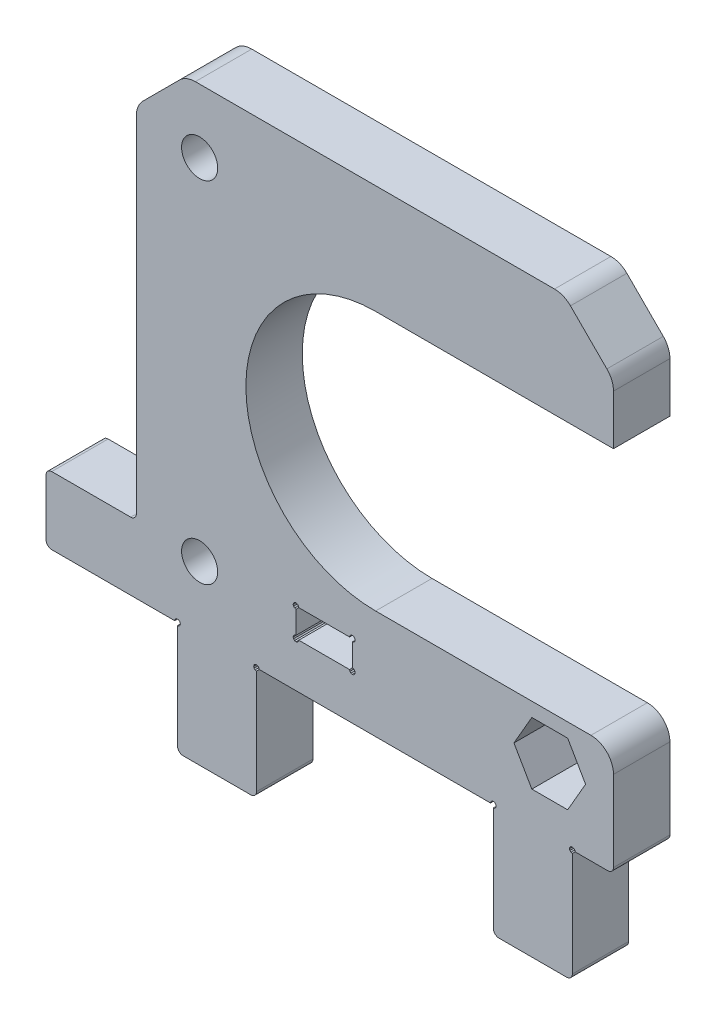
from build123d import *

# Parameters (mm, degrees)
ESQUISSE1_R        = 1.6
BOSS_EXTRU_1_DEPTH = 5


with BuildPart() as part:
    # Esquisse1 → Boss.-Extru.1 (new body)
    with BuildSketch(Plane(origin=(0, 0, 0), x_dir=(-1, 0, 0), z_dir=(0, 0, -1))):
        with BuildLine():
            Line((-13.228382526, 52.300004127), (-45.071523458, 52.300004127))
            ThreePointArc((-45.071523458, 52.300004127), (-45.836893076, 52.147762644), (-46.485742108, 51.714215582))
            Line((-46.485742108, 51.714215582), (-49.714164045, 48.485793645))
            ThreePointArc((-49.714164045, 48.485793645), (-50.147712239, 47.836942919), (-50.299954119, 47.071571303))
            Line((-50.299954119, 47.071571303), (-50.299954119, 42.65))
            Line((-50.299954119, 42.65), (-29.210001453, 42.65))
            ThreePointArc((-29.210001453, 42.65), (-17.71, 31.15), (-29.210001453, 19.65))
            Line((-29.210001453, 19.65), (-48.299953866, 19.65))
            ThreePointArc((-48.299953866, 19.65), (-49.714167607, 19.064213488), (-50.299954119, 17.649999747))
            Line((-50.299954119, 17.649999747), (-50.299954119, 10.499998844))
            ThreePointArc((-50.299954119, 10.499998844), (-50.153507491, 10.146445408), (-49.799954056, 9.99999878))
            Line((-49.799954056, 9.99999878), (-46.899953689, 9.99999878))
            Line((-46.899953689, 9.99999878), (-46.866453685, 10.124998796))
            Line((-46.866453685, 10.124998796), (-46.774953673, 10.216508808))
            Line((-46.774953673, 10.216508808), (-46.649953658, 10.249998812))
            Line((-46.649953658, 10.249998812), (-46.524953642, 10.216508808))
            Line((-46.524953642, 10.216508808), (-46.43344363, 10.124998796))
            Line((-46.43344363, 10.124998796), (-46.399953626, 9.99999878))
            Line((-46.399953626, 9.99999878), (-46.43344363, 9.874998765))
            Line((-46.43344363, 9.874998765), (-46.524953642, 9.783491753))
            Line((-46.524953642, 9.783491753), (-46.649953658, 9.749998749))
            Line((-46.649953658, 9.749998749), (-46.649953658, 0.49999758))
            ThreePointArc((-46.649953658, 0.49999758), (-46.50350703, 0.146444144), (-46.149953594, -2.484e-06))
            Line((-46.149953594, -2.484e-06), (-40.149952936, -2.484e-06))
            ThreePointArc((-40.149952936, -2.484e-06), (-39.79639943, 0.146444174), (-39.649952773, 0.49999768))
            Line((-39.649952773, 0.49999768), (-39.649952773, 9.749998749))
            Line((-39.649952773, 9.749998749), (-39.774952789, 9.783491753))
            Line((-39.774952789, 9.783491753), (-39.8664628, 9.874998765))
            Line((-39.8664628, 9.874998765), (-39.899952805, 9.99999878))
            Line((-39.899952805, 9.99999878), (-39.8664628, 10.124998796))
            Line((-39.8664628, 10.124998796), (-39.774952789, 10.216508808))
            Line((-39.774952789, 10.216508808), (-39.649952773, 10.249998812))
            Line((-39.649952773, 10.249998812), (-39.524952757, 10.216508808))
            Line((-39.524952757, 10.216508808), (-39.433442746, 10.124998796))
            Line((-39.433442746, 10.124998796), (-39.399952741, 9.99999878))
            Line((-39.399952741, 9.99999878), (-18.89995015, 9.99999878))
            Line((-18.89995015, 9.99999878), (-18.866450146, 10.124998796))
            Line((-18.866450146, 10.124998796), (-18.774950135, 10.216508808))
            Line((-18.774950135, 10.216508808), (-18.649950119, 10.249998812))
            Line((-18.649950119, 10.249998812), (-18.524950103, 10.216508808))
            Line((-18.524950103, 10.216508808), (-18.433440091, 10.124998796))
            Line((-18.433440091, 10.124998796), (-18.399950087, 9.99999878))
            Line((-18.399950087, 9.99999878), (-18.433440091, 9.874998765))
            Line((-18.433440091, 9.874998765), (-18.524950103, 9.783491753))
            Line((-18.524950103, 9.783491753), (-18.649950119, 9.749998749))
            Line((-18.649950119, 9.749998749), (-18.649950119, 0.49999758))
            ThreePointArc((-18.649950119, 0.49999758), (-18.503503491, 0.146444144), (-18.149950056, -2.484e-06))
            Line((-18.149950056, -2.484e-06), (-12.149949397, -2.484e-06))
            ThreePointArc((-12.149949397, -2.484e-06), (-11.796395891, 0.146444174), (-11.649949234, 0.49999768))
            Line((-11.649949234, 0.49999768), (-11.649949234, 9.749998749))
            Line((-11.649949234, 9.749998749), (-11.77494925, 9.783491753))
            Line((-11.77494925, 9.783491753), (-11.866459261, 9.874998765))
            Line((-11.866459261, 9.874998765), (-11.899949266, 9.99999878))
            Line((-11.899949266, 9.99999878), (-11.866459261, 10.124998796))
            Line((-11.866459261, 10.124998796), (-11.77494925, 10.216508808))
            Line((-11.77494925, 10.216508808), (-11.649949234, 10.249998812))
            Line((-11.649949234, 10.249998812), (-11.524949218, 10.216508808))
            Line((-11.524949218, 10.216508808), (-11.433439207, 10.124998796))
            Line((-11.433439207, 10.124998796), (-11.399949202, 9.99999878))
            Line((-11.399949202, 9.99999878), (-0.499947825, 9.99999878))
            ThreePointArc((-0.499947825, 9.99999878), (-0.14639439, 10.146445408), (5.2238e-05, 10.499998844))
            Line((5.2238e-05, 10.499998844), (5.2238e-05, 15.499999475))
            ThreePointArc((5.2238e-05, 15.499999475), (-0.14639439, 15.853552911), (-0.499947825, 15.999999539))
            Line((-0.499947825, 15.999999539), (-7.49994871, 15.999999539))
            ThreePointArc((-7.49994871, 15.999999539), (-7.853502145, 16.146446167), (-7.999948773, 16.499999602))
            Line((-7.999948773, 16.499999602), (-7.999948773, 47.071573466))
            ThreePointArc((-7.999948773, 47.071573466), (-8.152190984, 47.836946285), (-8.585740096, 48.485797894))
            Line((-8.585740096, 48.485797894), (-11.814159255, 51.714214053))
            ThreePointArc((-11.814159255, 51.714214053), (-12.46301048, 52.147762254), (-13.228382526, 52.300004127))
        make_face()
        with Locations((-13.61, 46.65)):
            Circle(ESQUISSE1_R, mode=Mode.SUBTRACT)
        with Locations((-13.61, 15.65)):
            Circle(ESQUISSE1_R, mode=Mode.SUBTRACT)
        Polygon((-22.025002784, 14.216511797), (-21.933492772, 14.125001785), (-21.900002768, 14.000001769), (-21.933492772, 13.875001754), (-22.025002784, 13.783491742), (-22.1500028, 13.750001738), (-22.275002815, 13.783491742), (-22.366502827, 13.875001754), (-22.400002831, 14.000001769), (-26.9000034, 14.000001769), (-26.933493404, 13.875001754), (-27.025003416, 13.783491742), (-27.150003431, 13.750001738), (-27.275003447, 13.783491742), (-27.366513459, 13.875001754), (-27.400003463, 14.000001769), (-27.366513459, 14.125001785), (-27.275003447, 14.216511797), (-27.150003431, 14.250001801), (-27.150003431, 16.250002054), (-27.275003447, 16.283492058), (-27.366513459, 16.37500207), (-27.400003463, 16.500002085), (-27.366513459, 16.625002101), (-27.275003447, 16.716512113), (-27.150003431, 16.750002117), (-27.025003416, 16.716512113), (-26.933493404, 16.625002101), (-26.9000034, 16.500002085), (-22.400002831, 16.500002085), (-22.366502827, 16.625002101), (-22.275002815, 16.716512113), (-22.1500028, 16.750002117), (-22.025002784, 16.716512113), (-21.933492772, 16.625002101), (-21.900002768, 16.500002085), (-21.933492772, 16.37500207), (-22.025002784, 16.283492058), (-22.1500028, 16.250002054), (-22.1500028, 14.250001801), align=None, mode=Mode.SUBTRACT)
        Polygon((-43.062295443, 18.400002326), (-41.474585242, 15.650001978), (-43.062295443, 12.90000163), (-46.237715844, 12.90000163), (-47.825426045, 15.650001978), (-46.237715844, 18.400002326), align=None, mode=Mode.SUBTRACT)
    extrude(amount=-BOSS_EXTRU_1_DEPTH)


solid = part.part
